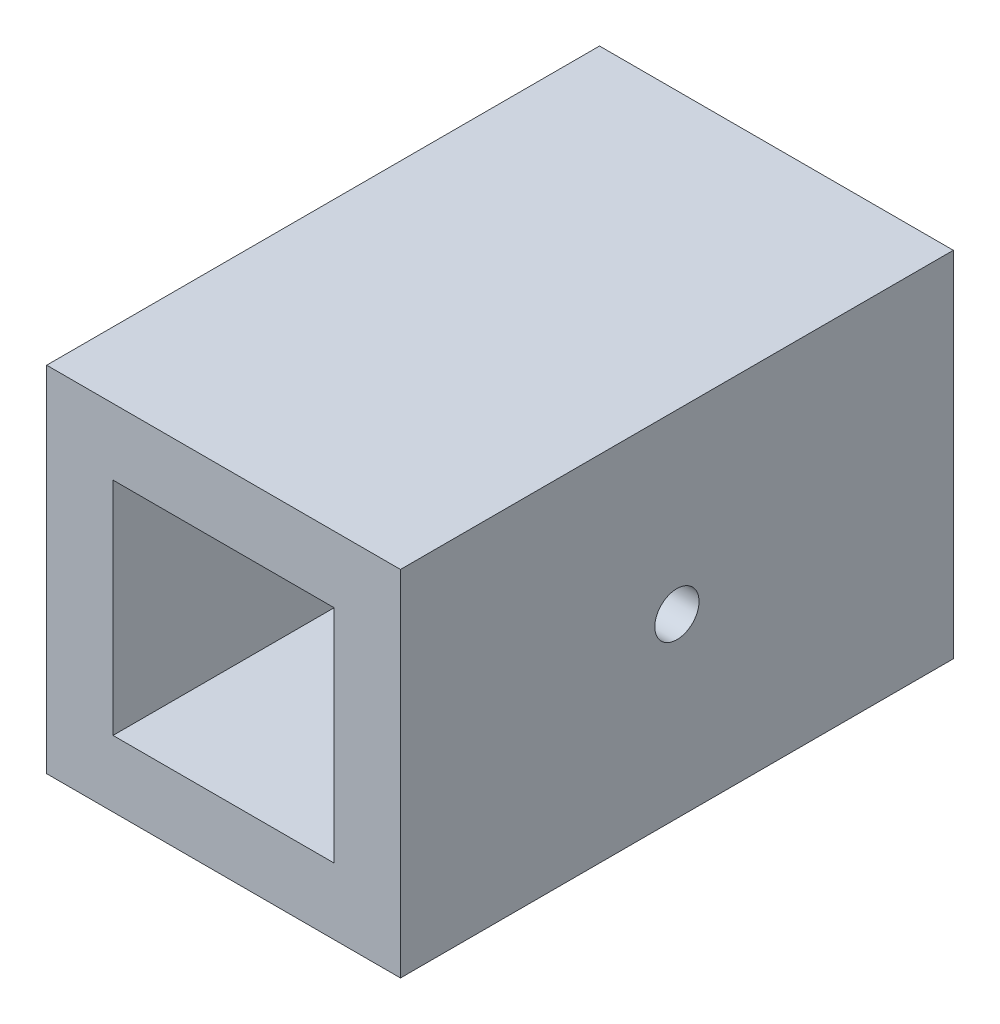
from build123d import *

# Parameters (mm, degrees)
SKETCH_1_W          = 16
SKETCH_1_H          = 16
SKETCH_1_W_2        = 10
SKETCH_1_H_2        = 10
EXTRUDE_1_DEPTH     = 10
SKETCH_2_W          = 16
SKETCH_2_H          = 16
EXTRUDE_2_DEPTH     = 5
SKETCH_3_W          = 16
SKETCH_3_H          = 16
SKETCH_3_W_2        = 10
SKETCH_3_H_2        = 10
EXTRUDE_3_DEPTH     = 10
SKETCH_6_R          = 1
CUT_EXTRUDE_1_DEPTH = 16


with BuildPart() as part:
    # 草图1 → 凸台-拉伸1 (new body)
    with BuildSketch(Plane.XY):
        with Locations((8, 8)):
            Rectangle(SKETCH_1_W, SKETCH_1_H)
        with Locations((8, 8)):
            Rectangle(SKETCH_1_W_2, SKETCH_1_H_2, mode=Mode.SUBTRACT)
    extrude(amount=EXTRUDE_1_DEPTH)

    # 草图2 → 凸台-拉伸2 (add)
    with BuildSketch(Plane.XY.offset(10)):
        with Locations((8, 8)):
            Rectangle(SKETCH_2_W, SKETCH_2_H)
    extrude(amount=EXTRUDE_2_DEPTH)

    # 草图3 → 凸台-拉伸3 (add)
    with BuildSketch(Plane.XY.offset(15)):
        with Locations((8, 8)):
            Rectangle(SKETCH_3_W, SKETCH_3_H)
        with Locations((8, 8)):
            Rectangle(SKETCH_3_W_2, SKETCH_3_H_2, mode=Mode.SUBTRACT)
    extrude(amount=EXTRUDE_3_DEPTH)

    # 草图6 → 切除-拉伸1 (cut)
    with BuildSketch(Plane(origin=(16, 0, 0), x_dir=(0, 0, -1), z_dir=(1, 0, 0))):
        with Locations((-12.5, 8)):
            Circle(SKETCH_6_R)
    extrude(amount=-CUT_EXTRUDE_1_DEPTH, mode=Mode.SUBTRACT)


solid = part.part
